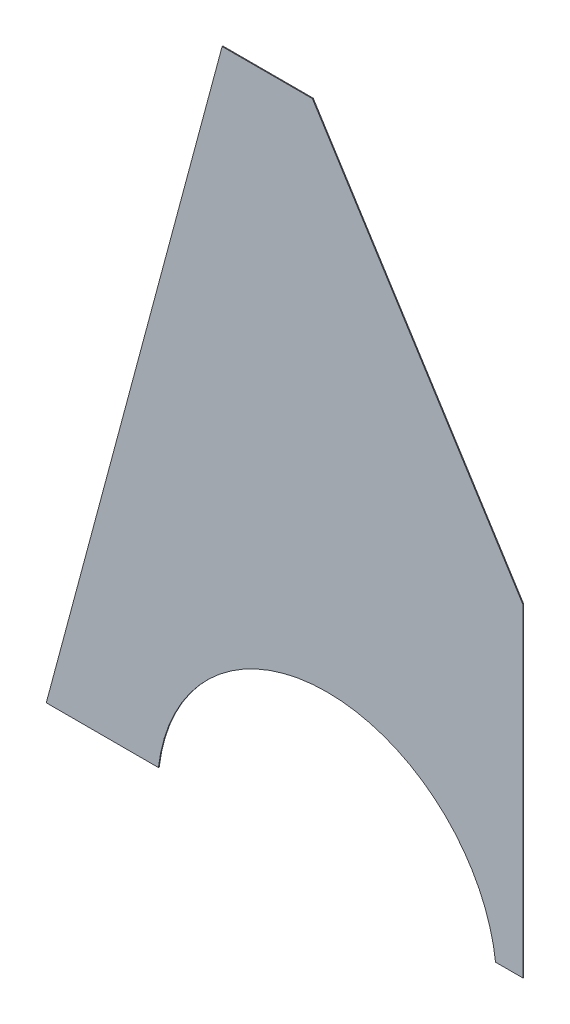
from build123d import *

# Parameters (mm, degrees)
BOSS_EXTRUDE1_DEPTH = 1.5


with BuildPart() as part:
    # Sketch1 → Boss-Extrude1 (new body)
    with BuildSketch(Plane.XY):
        with BuildLine():
            Line((100.41499283, 808.450676409), (265.41499283, 808.450676409))
            Line((265.41499283, 808.450676409), (650.236066342, 199.917405846))
            Line((650.236066342, 199.917405846), (650.236066342, -391.229199842))
            Line((650.236066342, -391.229199842), (600.236066342, -391.229199842))
            ThreePointArc((600.236066342, -391.229199842), (292.098902578, -117.502355805), (-16.038261187, -391.229199842))
            Line((-16.038261187, -391.229199842), (-221.038261187, -391.229199842))
            Line((-221.038261187, -391.229199842), (100.41499283, 808.450676409))
        make_face()
    extrude(amount=BOSS_EXTRUDE1_DEPTH)


solid = part.part
